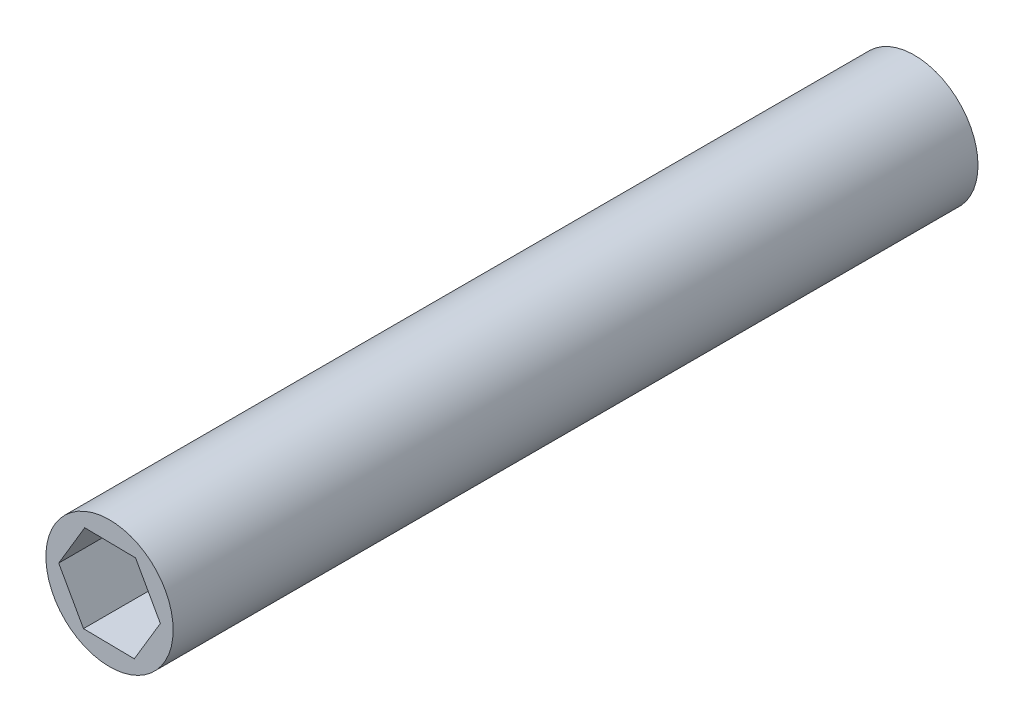
from build123d import *

# Parameters (mm, degrees)
SKETCH2_R           = 16.052702668
BOSS_EXTRUDE1_DEPTH = 203
CUT_EXTRUDE1_DEPTH  = 476


with BuildPart() as part:
    # Sketch2 → Boss-Extrude1 (new body)
    with BuildSketch(Plane.XY):
        Circle(SKETCH2_R)
    extrude(amount=-BOSS_EXTRUDE1_DEPTH)

    # Sketch5 → Cut-Extrude1 (cut)
    with BuildSketch(Plane.XY):
        Polygon((6.249490897, -11.192871263), (12.818056304, -0.184217754), (6.568565406, 11.008653509), (-6.249490897, 11.192871263), (-12.818056304, 0.184217754), (-6.568565406, -11.008653509), align=None)
    extrude(amount=-CUT_EXTRUDE1_DEPTH, mode=Mode.SUBTRACT)


solid = part.part
